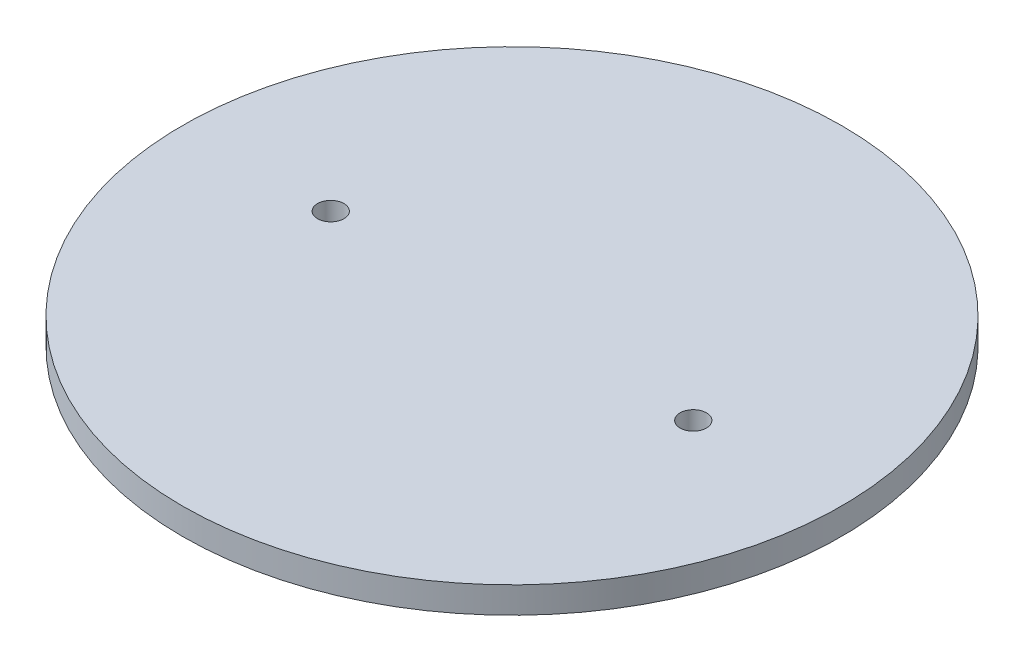
from build123d import *

# Parameters (mm, degrees)
SKETCH1_R           = 50
SKETCH1_R_2         = 2
BOSS_EXTRUDE1_DEPTH = 4


with BuildPart() as part:
    # Sketch1 → Boss-Extrude1 (new body)
    with BuildSketch(Plane(origin=(0, 0, 0), x_dir=(1, 0, 0), z_dir=(0, 1, 0))):
        with Locations(Location((0, 0, 0), (0, 0, 270))):
            Circle(SKETCH1_R)
        with Locations(Location((-27.5, 0, 0), (0, 0, 270))):
            Circle(SKETCH1_R_2, mode=Mode.SUBTRACT)
        with Locations(Location((27.5, 0, 0), (0, 0, 270))):
            Circle(SKETCH1_R_2, mode=Mode.SUBTRACT)
    extrude(amount=BOSS_EXTRUDE1_DEPTH)


solid = part.part
